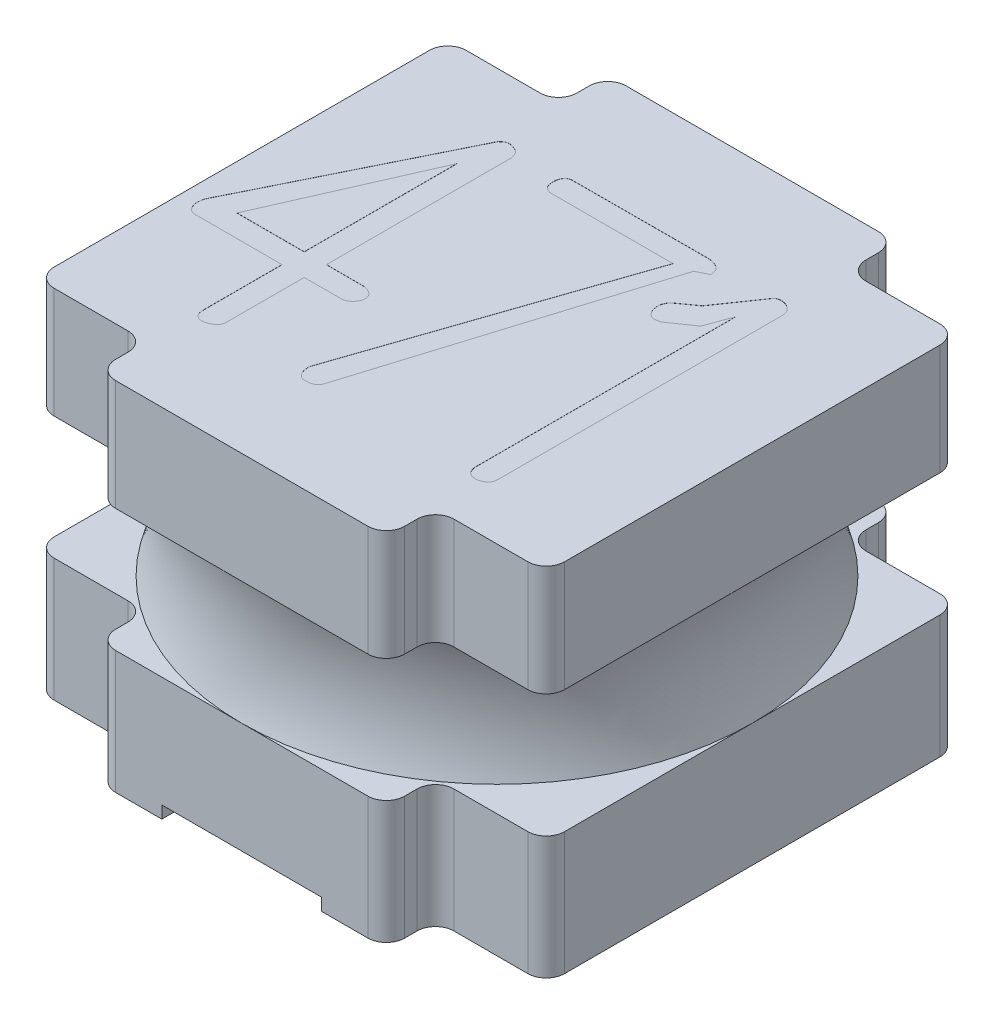
from build123d import *

# Parameters (mm, degrees)
BOSS_EXTRUDE1_DEPTH = 0.9
BOSS_EXTRUDE2_START = 1.9
BOSS_EXTRUDE2_DEPTH = 0.9
CUT_EXTRUDE1_START  = 2.8
CUT_EXTRUDE1_DEPTH  = 0.001
BOSS_EXTRUDE3_START = 0.1
BOSS_EXTRUDE3_DEPTH = 0.1


with BuildPart() as part:
    # Sketch1 → Boss-Extrude1 (new body)
    with BuildSketch(Plane(origin=(0, 0, 0), x_dir=(1, 0, 0), z_dir=(0, 1, 0))):
        with BuildLine():
            Line((-1.025, 2.075), (1.025, 2.075))
            ThreePointArc((1.025, 2.075), (1.131066017, 2.031066017), (1.175, 1.925))
            Line((1.175, 1.925), (1.175, 1.825))
            ThreePointArc((1.175, 1.825), (1.218933983, 1.718933983), (1.325, 1.675))
            Line((1.325, 1.675), (1.925, 1.675))
            ThreePointArc((1.925, 1.675), (2.031066017, 1.631066017), (2.075, 1.525))
            Line((2.075, 1.525), (2.075, -1.525))
            ThreePointArc((2.075, -1.525), (2.031066017, -1.631066017), (1.925, -1.675))
            Line((1.925, -1.675), (1.325, -1.675))
            ThreePointArc((1.325, -1.675), (1.218933983, -1.718933983), (1.175, -1.825))
            Line((1.175, -1.825), (1.175, -1.925))
            ThreePointArc((1.175, -1.925), (1.131066017, -2.031066017), (1.025, -2.075))
            Line((1.025, -2.075), (-1.025, -2.075))
            ThreePointArc((-1.025, -2.075), (-1.131066017, -2.031066017), (-1.175, -1.925))
            Line((-1.175, -1.925), (-1.175, -1.825))
            ThreePointArc((-1.175, -1.825), (-1.218933983, -1.718933983), (-1.325, -1.675))
            Line((-1.325, -1.675), (-1.925, -1.675))
            ThreePointArc((-1.925, -1.675), (-2.031066017, -1.631066017), (-2.075, -1.525))
            Line((-2.075, -1.525), (-2.075, 1.525))
            ThreePointArc((-2.075, 1.525), (-2.031066017, 1.631066017), (-1.925, 1.675))
            Line((-1.925, 1.675), (-1.325, 1.675))
            ThreePointArc((-1.325, 1.675), (-1.218933983, 1.718933983), (-1.175, 1.825))
            Line((-1.175, 1.825), (-1.175, 1.925))
            ThreePointArc((-1.175, 1.925), (-1.131066017, 2.031066017), (-1.025, 2.075))
        make_face()
    extrude(amount=BOSS_EXTRUDE1_DEPTH)

    # Sketch2 → Revolve1 (revolve)
    with BuildSketch(Plane.XY):
        with BuildLine():
            Line((-2.075, 1.9), (0, 1.9))
            Line((0, 1.9), (0, 0.9))
            Line((0, 0.9), (-2.075, 0.9))
            ThreePointArc((-2.075, 0.9), (-2, 1.4), (-2.075, 1.9))
        make_face()
    revolve(axis=Axis((0, 1.9, 0), (0, -1, 0)))

    # Sketch1<2> → Boss-Extrude2 (add)
    with BuildSketch(Plane(origin=(0, 0, 0), x_dir=(1, 0, 0), z_dir=(0, 1, 0)).offset(BOSS_EXTRUDE2_START)):
        with BuildLine():
            Line((-1.025, 2.075), (1.025, 2.075))
            ThreePointArc((1.025, 2.075), (1.131066017, 2.031066017), (1.175, 1.925))
            Line((1.175, 1.925), (1.175, 1.825))
            ThreePointArc((1.175, 1.825), (1.218933983, 1.718933983), (1.325, 1.675))
            Line((1.325, 1.675), (1.925, 1.675))
            ThreePointArc((1.925, 1.675), (2.031066017, 1.631066017), (2.075, 1.525))
            Line((2.075, 1.525), (2.075, -1.525))
            ThreePointArc((2.075, -1.525), (2.031066017, -1.631066017), (1.925, -1.675))
            Line((1.925, -1.675), (1.325, -1.675))
            ThreePointArc((1.325, -1.675), (1.218933983, -1.718933983), (1.175, -1.825))
            Line((1.175, -1.825), (1.175, -1.925))
            ThreePointArc((1.175, -1.925), (1.131066017, -2.031066017), (1.025, -2.075))
            Line((1.025, -2.075), (-1.025, -2.075))
            ThreePointArc((-1.025, -2.075), (-1.131066017, -2.031066017), (-1.175, -1.925))
            Line((-1.175, -1.925), (-1.175, -1.825))
            ThreePointArc((-1.175, -1.825), (-1.218933983, -1.718933983), (-1.325, -1.675))
            Line((-1.325, -1.675), (-1.925, -1.675))
            ThreePointArc((-1.925, -1.675), (-2.031066017, -1.631066017), (-2.075, -1.525))
            Line((-2.075, -1.525), (-2.075, 1.525))
            ThreePointArc((-2.075, 1.525), (-2.031066017, 1.631066017), (-1.925, 1.675))
            Line((-1.925, 1.675), (-1.325, 1.675))
            ThreePointArc((-1.325, 1.675), (-1.218933983, 1.718933983), (-1.175, 1.825))
            Line((-1.175, 1.825), (-1.175, 1.925))
            ThreePointArc((-1.175, 1.925), (-1.131066017, 2.031066017), (-1.025, 2.075))
        make_face()
    extrude(amount=BOSS_EXTRUDE2_DEPTH)

    # Sketch3 → Cut-Extrude1 (cut)
    # profile 1 of 3: a face of its own
    with BuildSketch(Plane(origin=(0, 0, 0), x_dir=(1, 0, 0), z_dir=(0, 1, 0)).offset(CUT_EXTRUDE1_START)):
        with BuildLine():
            Line((-0.994823042, 1.134638554), (-0.984939759, 1.101223645))
            Line((-0.984939759, 1.101223645), (-0.984939759, -0.401506024))
            Line((-0.984939759, -0.401506024), (-0.678087349, -0.401976657))
            add(Edge.make_bspline(
                [(-0.678087349, -0.401976657), (-0.66550397, -0.404824021), (-0.642681119, -0.409988371), (-0.613221892, -0.425633439), (-0.593599701, -0.449118084), (-0.589373439, -0.467876363), (-0.587255271, -0.477277861)],
                knots=[0, 0, 0, 0, 1.215328897, 2.204278197, 3.099998701, 4, 4, 4, 4], degree=3))
            add(Edge.make_bspline(
                [(-0.587255271, -0.477277861), (-0.587716745, -0.485994899), (-0.588635147, -0.503343118), (-0.598693247, -0.528100995), (-0.615443191, -0.550309277), (-0.62996279, -0.562583892), (-0.637612952, -0.569051205)],
                knots=[0, 0, 0, 0, 0.957983476, 1.906531559, 2.896982572, 4, 4, 4, 4], degree=3))
            Line((-0.637612952, -0.569051205), (-0.668674699, -0.582228916))
            Line((-0.668674699, -0.582228916), (-0.984939759, -0.582228916))
            Line((-0.984939759, -0.582228916), (-0.985881024, -1.22840738))
            add(Edge.make_bspline(
                [(-0.985881024, -1.22840738), (-0.987644101, -1.234334769), (-0.991103656, -1.245965643), (-1.001117182, -1.261337977), (-1.013822585, -1.275069256), (-1.035360982, -1.287280609), (-1.06041207, -1.299492506), (-1.081311882, -1.303419922), (-1.090361446, -1.305120482)],
                knots=[0, 0, 0, 0, 0.805252688, 1.580087297, 2.378768529, 3.227606986, 4.799561142, 6, 6, 6, 6], degree=3))
            add(Edge.make_bspline(
                [(-1.090361446, -1.305120482), (-1.096193195, -1.304874445), (-1.107398567, -1.304401698), (-1.122950919, -1.300179085), (-1.136307419, -1.293349498), (-1.147495136, -1.283899175), (-1.155450803, -1.27091917), (-1.161719606, -1.255890514), (-1.164713634, -1.237927566), (-1.165332398, -1.225276405), (-1.165662651, -1.218524096)],
                knots=[0, 0, 0, 0, 1.065998616, 2.048255232, 2.921634539, 3.796900197, 4.68896353, 5.680827818, 6.762187436, 8, 8, 8, 8], degree=3))
            Line((-1.165662651, -1.218524096), (-1.165662651, -0.582228916))
            Line((-1.165662651, -0.582228916), (-1.881965361, -0.582228916))
            add(Edge.make_bspline(
                [(-1.881965361, -0.582228916), (-1.890235627, -0.579801688), (-1.906599768, -0.574999002), (-1.926840188, -0.557665331), (-1.941176277, -0.53344916), (-1.946139793, -0.514638109), (-1.948795181, -0.504574548)],
                knots=[0, 0, 0, 0, 0.941431283, 1.862783672, 2.856629137, 4, 4, 4, 4], degree=3))
            Line((-1.948795181, -0.504574548), (-1.948795181, -0.481042922))
            add(Edge.make_bspline(
                [(-1.948795181, -0.481042922), (-1.948155239, -0.469764642), (-1.946889298, -0.447453778), (-1.938402327, -0.426786237), (-1.934205572, -0.416566265)],
                knots=[0, 0, 0, 0, 1.011012346, 2, 2, 2, 2], degree=3))
            Line((-1.934205572, -0.416566265), (-1.842902861, -0.233490211))
            Line((-1.842902861, -0.233490211), (-1.155308735, 1.160523343))
            add(Edge.make_bspline(
                [(-1.155308735, 1.160523343), (-1.150114773, 1.165699136), (-1.140446155, 1.175333934), (-1.124903309, 1.186535562), (-1.109357387, 1.193129977), (-1.099039737, 1.194315145), (-1.094126506, 1.194879518)],
                knots=[0, 0, 0, 0, 1.221821346, 2.274434324, 3.178291236, 4, 4, 4, 4], degree=3))
            add(Edge.make_bspline(
                [(-1.094126506, 1.194879518), (-1.089248859, 1.194169836), (-1.079434558, 1.192741887), (-1.069795696, 1.190406594), (-1.064947289, 1.189231928)],
                knots=[0, 0, 0, 0, 0.993987759, 2, 2, 2, 2], degree=3))
            add(Edge.make_bspline(
                [(-1.064947289, 1.189231928), (-1.055863777, 1.186262911), (-1.039137911, 1.180795931), (-1.017762291, 1.168522954), (-1.001855207, 1.15334397), (-0.997095751, 1.140683913), (-0.994823042, 1.134638554)],
                knots=[0, 0, 0, 0, 1.232626505, 2.269688945, 3.173751694, 4, 4, 4, 4], degree=3))
        make_face()
        Polygon((-1.712067018, -0.401506024), (-1.165662651, -0.401506024), (-1.165662651, 0.84002259), align=None, mode=Mode.SUBTRACT)
    # profile 2 of 3: a face of its own
    with BuildSketch(Plane(origin=(0, 0, 0), x_dir=(1, 0, 0), z_dir=(0, 1, 0)).offset(CUT_EXTRUDE1_START)):
        with BuildLine():
            add(Edge.make_bspline(
                [(0.636765813, 1.140756777), (0.639596972, 1.130621496), (0.644264384, 1.113912603), (0.646313547, 1.096700176), (0.647119729, 1.089928464)],
                knots=[0, 0, 0, 0, 1.213160156, 2, 2, 2, 2], degree=3))
            add(Edge.make_bspline(
                [(0.647119729, 1.089928464), (0.631497297, 1.083057896), (0.600197706, 1.069292693), (0.57000067, 1.053252495), (0.554875753, 1.045218373)],
                knots=[0, 0, 0, 0, 0.998251522, 2, 2, 2, 2], degree=3))
            Line((0.554875753, 1.045218373), (-0.155779367, -1.252409639))
            add(Edge.make_bspline(
                [(-0.155779367, -1.252409639), (-0.159567902, -1.260556313), (-0.167183435, -1.27693237), (-0.190615951, -1.293880066), (-0.220573355, -1.303726615), (-0.24290759, -1.304628714), (-0.255082831, -1.305120482)],
                knots=[0, 0, 0, 0, 0.884311535, 1.777601082, 2.788485749, 4, 4, 4, 4], degree=3))
            add(Edge.make_bspline(
                [(-0.255082831, -1.305120482), (-0.263421483, -1.304505685), (-0.279565059, -1.303315441), (-0.301024691, -1.290555011), (-0.318942079, -1.271383562), (-0.325763129, -1.254472753), (-0.329442771, -1.245350151)],
                knots=[0, 0, 0, 0, 0.96935304, 1.876661176, 2.854556472, 4, 4, 4, 4], degree=3))
            add(Edge.make_bspline(
                [(-0.329442771, -1.245350151), (-0.331265797, -1.23737923), (-0.335721751, -1.217896208), (-0.335620702, -1.197878492), (-0.335560994, -1.186050452)],
                knots=[0, 0, 0, 0, 0.818242728, 2, 2, 2, 2], degree=3))
            Line((-0.335560994, -1.186050452), (0.416039157, 1.014156627))
            Line((0.416039157, 1.014156627), (-0.583113705, 1.014156627))
            add(Edge.make_bspline(
                [(-0.583113705, 1.014156627), (-0.590792305, 1.01627557), (-0.605373974, 1.020299445), (-0.624426255, 1.032420652), (-0.637753245, 1.050450101), (-0.642053446, 1.064643036), (-0.644295934, 1.072044428)],
                knots=[0, 0, 0, 0, 1.064496322, 2.021479773, 2.968232787, 4, 4, 4, 4], degree=3))
            add(Edge.make_bspline(
                [(-0.644295934, 1.072044428), (-0.644986848, 1.076273169), (-0.646743624, 1.087025512), (-0.647270623, 1.097912674), (-0.647590361, 1.104518072)],
                knots=[0, 0, 0, 0, 0.786571229, 2, 2, 2, 2], degree=3))
            add(Edge.make_bspline(
                [(-0.647590361, 1.104518072), (-0.646688301, 1.115640539), (-0.644941572, 1.137177817), (-0.633446343, 1.161980902), (-0.620130237, 1.17781826), (-0.606982532, 1.186175372), (-0.591840568, 1.191562307), (-0.580809023, 1.191887705), (-0.575112952, 1.192055723)],
                knots=[0, 0, 0, 0, 1.564100289, 3.028686249, 3.765309405, 4.452446273, 5.200929956, 6, 6, 6, 6], degree=3))
            Line((-0.575112952, 1.192055723), (0.534167922, 1.194408886))
            add(Edge.make_bspline(
                [(0.534167922, 1.194408886), (0.547178865, 1.192078201), (0.570752357, 1.187855419), (0.600910463, 1.175480597), (0.623989289, 1.160735426), (0.632735142, 1.147059537), (0.636765813, 1.140756777)],
                knots=[0, 0, 0, 0, 1.319352066, 2.390428867, 3.258202531, 4, 4, 4, 4], degree=3))
        make_face()
    # profile 3 of 3: a face of its own
    with BuildSketch(Plane(origin=(0, 0, 0), x_dir=(1, 0, 0), z_dir=(0, 1, 0)).offset(CUT_EXTRUDE1_START)):
        with BuildLine():
            Line((1.216961596, 1.138403614), (1.225903614, 1.104518072))
            Line((1.225903614, 1.104518072), (1.225432982, -1.226995482))
            add(Edge.make_bspline(
                [(1.225432982, -1.226995482), (1.223555225, -1.236752025), (1.219876357, -1.255866873), (1.200154025, -1.279279411), (1.172407271, -1.296977671), (1.149792934, -1.302241557), (1.137424699, -1.305120482)],
                knots=[0, 0, 0, 0, 0.926923706, 1.816012601, 2.805533324, 4, 4, 4, 4], degree=3))
            add(Edge.make_bspline(
                [(1.137424699, -1.305120482), (1.12650507, -1.3046576), (1.106404762, -1.30380555), (1.079321841, -1.293459289), (1.059706574, -1.274600299), (1.053536527, -1.258401959), (1.050357681, -1.250056476)],
                knots=[0, 0, 0, 0, 1.170207105, 2.154058829, 3.048959964, 4, 4, 4, 4], degree=3))
            Line((1.050357681, -1.250056476), (1.045180723, -1.229348645))
            Line((1.045180723, -1.229348645), (1.045180723, 0.894145331))
            Line((1.045180723, 0.894145331), (0.969408886, 0.686596386))
            Line((0.969408886, 0.686596386), (0.779273343, 0.55528991))
            add(Edge.make_bspline(
                [(0.779273343, 0.55528991), (0.77193092, 0.553399115), (0.756908758, 0.54953066), (0.74149958, 0.547736002), (0.733621988, 0.546818524)],
                knots=[0, 0, 0, 0, 0.977545561, 2, 2, 2, 2], degree=3))
            add(Edge.make_bspline(
                [(0.733621988, 0.546818524), (0.728070153, 0.547137906), (0.717279519, 0.547758663), (0.701986131, 0.553987438), (0.688111523, 0.563571653), (0.67189462, 0.581518605), (0.656194307, 0.610711673), (0.654497355, 0.637099265), (0.653614458, 0.650828313)],
                knots=[0, 0, 0, 0, 0.684472364, 1.330351367, 2.014823731, 2.757238248, 4.312842215, 6, 6, 6, 6], degree=3))
            add(Edge.make_bspline(
                [(0.653614458, 0.650828313), (0.653789101, 0.656333833), (0.654125092, 0.666925748), (0.656005761, 0.677353251), (0.656908886, 0.682360693)],
                knots=[0, 0, 0, 0, 1.039570203, 2, 2, 2, 2], degree=3))
            add(Edge.make_bspline(
                [(0.656908886, 0.682360693), (0.661090928, 0.693595542), (0.668619661, 0.713821104), (0.6842964, 0.728532149), (0.69126506, 0.735071536)],
                knots=[0, 0, 0, 0, 1.110955416, 2, 2, 2, 2], degree=3))
            Line((0.69126506, 0.735071536), (0.833396084, 0.837198795))
            Line((0.833396084, 0.837198795), (1.061652861, 1.167582831))
            add(Edge.make_bspline(
                [(1.061652861, 1.167582831), (1.064769718, 1.171660859), (1.070960742, 1.179761061), (1.083418722, 1.189154265), (1.098712819, 1.193624581), (1.109322025, 1.194450427), (1.114834337, 1.194879518)],
                knots=[0, 0, 0, 0, 0.984513404, 1.95554287, 2.937744663, 4, 4, 4, 4], degree=3))
            add(Edge.make_bspline(
                [(1.114834337, 1.194879518), (1.124832169, 1.194348187), (1.144671087, 1.193293855), (1.172417008, 1.18166186), (1.197637503, 1.163754609), (1.210312417, 1.147126575), (1.216961596, 1.138403614)],
                knots=[0, 0, 0, 0, 0.981550807, 1.947712958, 2.923383228, 4, 4, 4, 4], degree=3))
        make_face()
    extrude(amount=-CUT_EXTRUDE1_DEPTH, mode=Mode.SUBTRACT)

    # Sketch4 → Boss-Extrude3 (add)
    with BuildSketch(Plane.XZ.offset(BOSS_EXTRUDE3_START)):
        with BuildLine():
            Line((-0.65, 2.075), (-0.65, -2.075))
            Line((-0.65, -2.075), (-1.025, -2.075))
            ThreePointArc((-1.025, -2.075), (-1.131066017, -2.031066017), (-1.175, -1.925))
            Line((-1.175, -1.925), (-1.175, -1.825))
            ThreePointArc((-1.175, -1.825), (-1.218933983, -1.718933983), (-1.325, -1.675))
            Line((-1.325, -1.675), (-1.925, -1.675))
            ThreePointArc((-1.925, -1.675), (-2.031066017, -1.631066017), (-2.075, -1.525))
            Line((-2.075, -1.525), (-2.075, 1.525))
            ThreePointArc((-2.075, 1.525), (-2.031066017, 1.631066017), (-1.925, 1.675))
            Line((-1.925, 1.675), (-1.325, 1.675))
            ThreePointArc((-1.325, 1.675), (-1.218933983, 1.718933983), (-1.175, 1.825))
            Line((-1.175, 1.825), (-1.175, 1.925))
            ThreePointArc((-1.175, 1.925), (-1.131066017, 2.031066017), (-1.025, 2.075))
            Line((-1.025, 2.075), (-0.65, 2.075))
        make_face()
        with BuildLine():
            Line((0.65, 2.075), (0.65, -2.075))
            Line((0.65, -2.075), (1.025, -2.075))
            ThreePointArc((1.025, -2.075), (1.131066017, -2.031066017), (1.175, -1.925))
            Line((1.175, -1.925), (1.175, -1.825))
            ThreePointArc((1.175, -1.825), (1.218933983, -1.718933983), (1.325, -1.675))
            Line((1.325, -1.675), (1.925, -1.675))
            ThreePointArc((1.925, -1.675), (2.031066017, -1.631066017), (2.075, -1.525))
            Line((2.075, -1.525), (2.075, 1.525))
            ThreePointArc((2.075, 1.525), (2.031066017, 1.631066017), (1.925, 1.675))
            Line((1.925, 1.675), (1.325, 1.675))
            ThreePointArc((1.325, 1.675), (1.218933983, 1.718933983), (1.175, 1.825))
            Line((1.175, 1.825), (1.175, 1.925))
            ThreePointArc((1.175, 1.925), (1.131066017, 2.031066017), (1.025, 2.075))
            Line((1.025, 2.075), (0.65, 2.075))
        make_face()
    extrude(amount=-BOSS_EXTRUDE3_DEPTH)


solid = part.part
